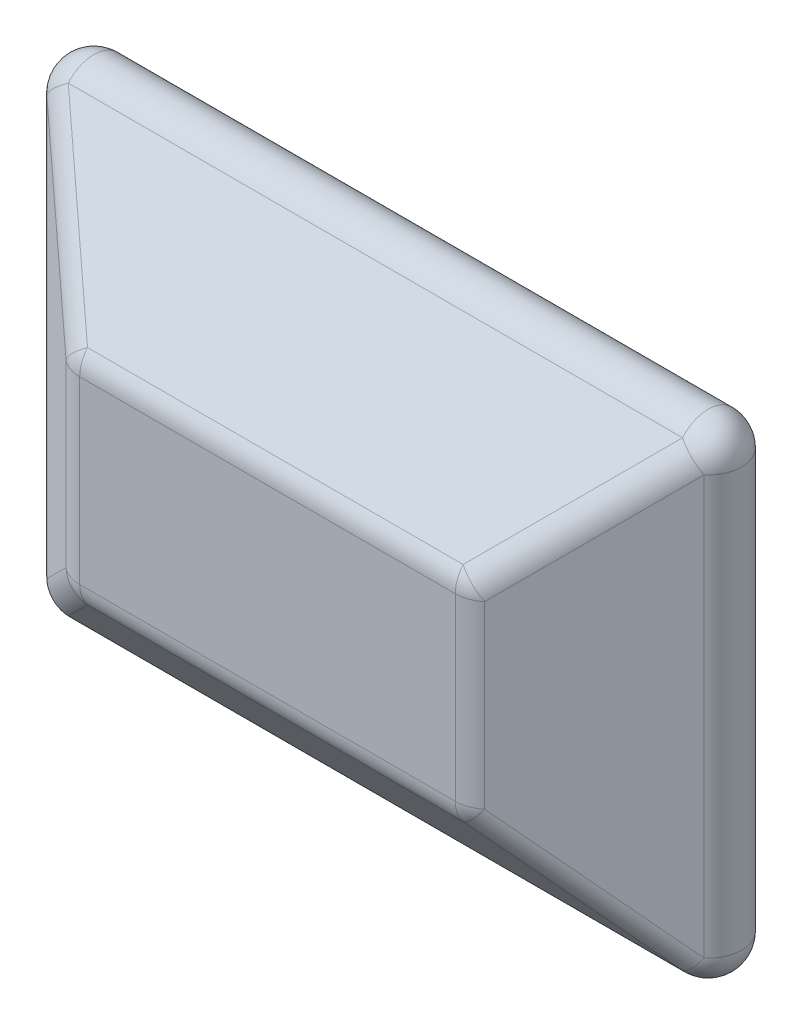
from build123d import *

# Parameters (mm, degrees)
SKETCH_1_W          = 119.8195585
SKETCH_1_H          = 61.146113558
EXTRUDE_1_DEPTH     = 50
DRAFT_8_ANGLE       = 50
FILLET_1_R          = 10
SKETCH_2_W          = 114.826849908
SKETCH_2_H          = 63.442671994
CUT_EXTRUDE_1_DEPTH = 34


with BuildPart() as part:
    # 草图1 → 凸台-拉伸1 (new body)
    with BuildSketch(Plane.XY):
        Rectangle(SKETCH_1_W, SKETCH_1_H)
    extrude(amount=EXTRUDE_1_DEPTH)

    # 拔模8
    draft_8_faces = [part.faces().sort_by_distance(p)[0] for p in [
        (-59.90977925, 0, 25),
        (0, -30.573056779, 25),
        (59.90977925, 0, 25),
        (0, 30.573056779, 25),
    ]]
    draft(draft_8_faces, Plane.XY.offset(50), DRAFT_8_ANGLE)

    # 圆角1
    fillet_1_edges = [part.edges().sort_by_distance(p)[0] for p in [
        (59.90977925, 0, 50),
        (0, 30.573056779, 50),
        (-59.90977925, 0, 50),
        (0, 90.160736408, 0),
        (119.49745888, 0, 0),
        (0, -90.160736408, 0),
        (-119.49745888, 0, 0),
        (0, -30.573056779, 50),
        (-89.703619065, 60.366896593, 25),
        (89.703619065, 60.366896593, 25),
        (89.703619065, -60.366896593, 25),
        (-89.703619065, -60.366896593, 25),
    ]]
    fillet(fillet_1_edges, radius=FILLET_1_R)

    # 草图2 → 切除-拉伸1 (cut)
    with BuildSketch(Plane(origin=(0, 0, 0), x_dir=(-1, 0, 0), z_dir=(0, 0, -1))):
        Rectangle(SKETCH_2_W, SKETCH_2_H)
    extrude(amount=-CUT_EXTRUDE_1_DEPTH, mode=Mode.SUBTRACT)


solid = part.part
